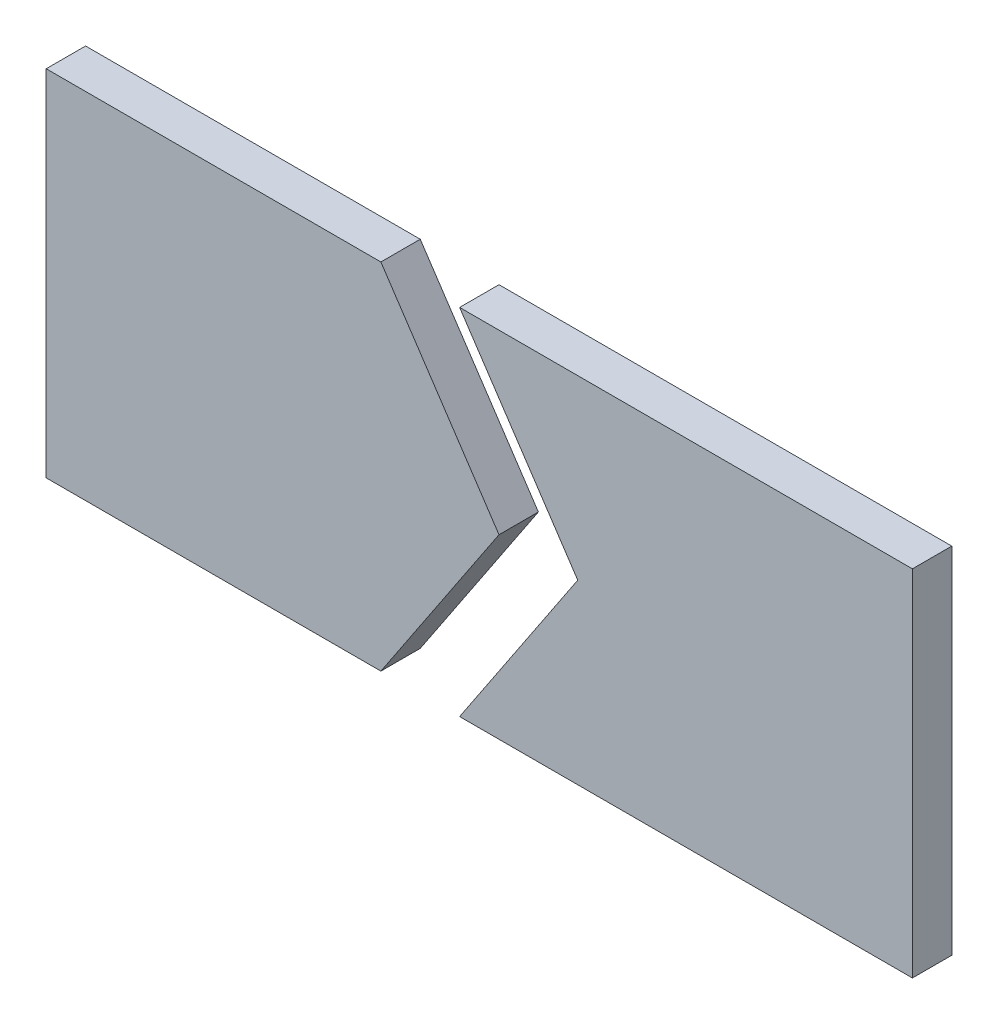
from build123d import *

# Parameters (mm, degrees)
BOSS_EXTRU_1_DEPTH   = 0.1
BOSS_EXTRU_1_2_DEPTH = 0.1


with BuildPart() as part:
    # Esquisse1 → Boss.-Extru.1 (new body)
    with BuildSketch(Plane.XY):
        Polygon((-1.1, 0.45), (-0.5, 0.45), (-0.25, 0.45), (0.05, 0), (-0.25, -0.45), (-0.5, -0.45), (-1.1, -0.45), align=None)
    extrude(amount=BOSS_EXTRU_1_DEPTH)


with BuildPart() as body_2:
    # Esquisse1 → Boss.-Extru.1 2 (new body)
    with BuildSketch(Plane.XY):
        Polygon((1.1, 0.45), (0.5, 0.45), (-0.05, 0.45), (0.25, 0), (-0.05, -0.45), (0.5, -0.45), (1.1, -0.45), align=None)
    extrude(amount=BOSS_EXTRU_1_2_DEPTH)


solid = Compound([part.part, body_2.part])
